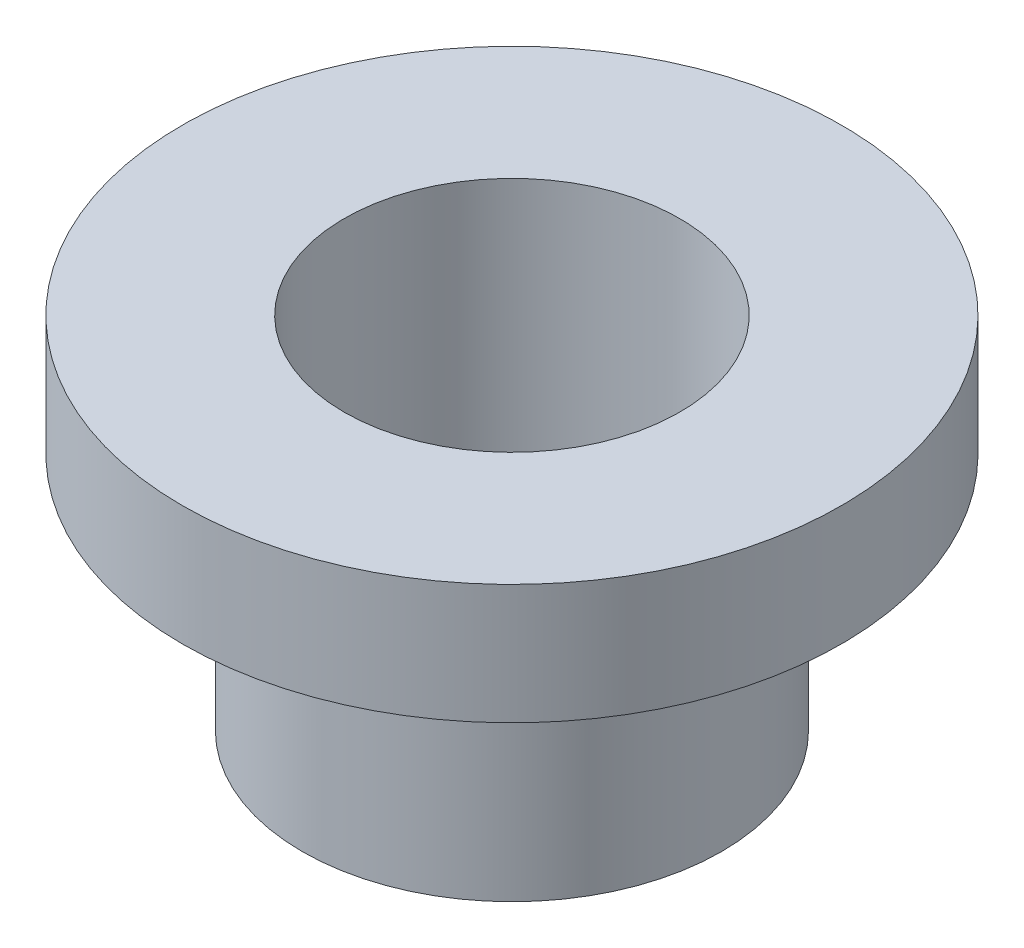
from build123d import *

# Parameters (mm, degrees)
SKETCH_1_R      = 1.75
SKETCH_1_R_2    = 1.4
EXTRUDE_5_DEPTH = 3
EXTRUDE_START   = -1
SKETCH_6_R      = 2.75
SKETCH_6_R_2    = 1.75
EXTRUDE_6_DEPTH = 1


with BuildPart() as part:
    # 草图1 → 凸台-拉伸5 (new body)
    with BuildSketch(Plane(origin=(0, 0, 0), x_dir=(1, 0, 0), z_dir=(0, 1, 0))):
        with Locations(Location((0, 0, 0), (0, 0, 270))):
            Circle(SKETCH_1_R)
        with Locations(Location((0, 0, 0), (0, 0, 270))):
            Circle(SKETCH_1_R_2, mode=Mode.SUBTRACT)
    extrude(amount=EXTRUDE_5_DEPTH)

    # 草图6 → 凸台-拉伸6 (add)
    with BuildSketch(Plane(origin=(0, 3, 0), x_dir=(1, 0, 0), z_dir=(0, 1, 0)).offset(EXTRUDE_START)):
        with Locations(Location((0, 0, 0), (0, 0, 270))):
            Circle(SKETCH_6_R)
        with Locations(Location((0, 0, 0), (0, 0, 270))):
            Circle(SKETCH_6_R_2, mode=Mode.SUBTRACT)
    extrude(amount=EXTRUDE_6_DEPTH)


solid = part.part
